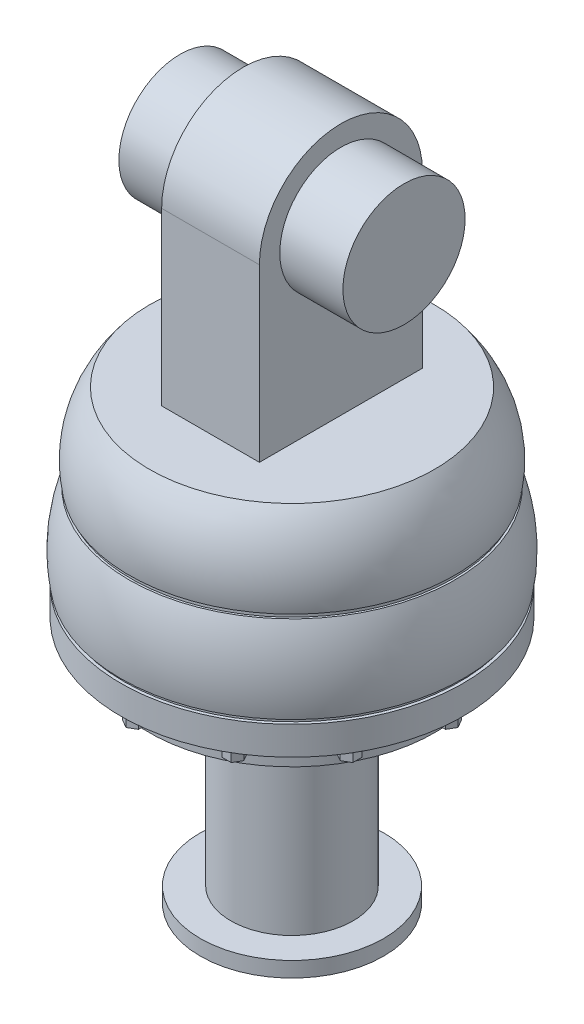
from build123d import *

# Parameters (mm, degrees)
SKETCH2_R            = 39.5
BOSS_EXTRUDE1_DEPTH  = 1
SKETCH4_R            = 41.25
BOSS_EXTRUDE2_DEPTH  = 1
SKETCH5_R            = 42
BOSS_EXTRUDE3_DEPTH  = 7
SKETCH6_R            = 35
BOSS_EXTRUDE4_DEPTH  = 7
BOSS_EXTRUDE7_DEPTH  = 3
CIRPATTERN2_COUNT    = 12
SKETCH8_R            = 15
BOSS_EXTRUDE8_DEPTH  = 50
SKETCH9_W            = 24
SKETCH9_H            = 40
BOSS_EXTRUDE9_DEPTH  = 42
BOSS_EXTRUDE10_START = -24
BOSS_EXTRUDE10_DEPTH = 24
SKETCH11_R           = 15
BOSS_EXTRUDE11_DEPTH = 15.5
BOSS_EXTRUDE12_START = 15.5
SKETCH12_R           = 15
BOSS_EXTRUDE12_DEPTH = 15.5
SKETCH13_R           = 22.5
BOSS_EXTRUDE13_DEPTH = 3.75


with BuildPart() as part:
    # Sketch1 → Revolve1 (revolve)
    with BuildSketch(Plane.XY):
        with BuildLine():
            Line((0, 0), (-35, 0))
            ThreePointArc((-35, 0), (-39.657515479, -9.46062113), (-40, -20))
            Line((-40, -20), (0, -20))
            Line((0, -20), (0, 0))
        make_face()
    revolve(axis=Axis((0, 0, 0), (0, -1, 0)))

    # Sketch2 → Boss-Extrude1 (add)
    with BuildSketch(Plane.XZ.offset(20)):
        Circle(SKETCH2_R)
    extrude(amount=BOSS_EXTRUDE1_DEPTH)

    # Sketch3 → Revolve2 (revolve)
    with BuildSketch(Plane(origin=(0, 0, 0), x_dir=(0, 0, -1), z_dir=(1, 0, 0)), mode=Mode.PRIVATE) as revolve2_sk:
        with BuildLine():
            Line((0, -21), (-40, -21))
            ThreePointArc((-40, -21), (-42.384109041, -30.861589096), (-42, -41))
            Line((-42, -41), (0, -41))
            Line((0, -41), (0, -21))
        make_face()
    revolve(revolve2_sk.sketch.rotate(Axis((0, -21, 0), (0, -1, 0)), 90), axis=Axis((0, -21, 0), (0, -1, 0)))

    # Sketch4 → Boss-Extrude2 (add)
    with BuildSketch(Plane.XZ.offset(41)):
        with Locations(Location((0, 0, 0), (0, 0, 270))):
            Circle(SKETCH4_R)
    extrude(amount=BOSS_EXTRUDE2_DEPTH)

    # Sketch5 → Boss-Extrude3 (add)
    with BuildSketch(Plane.XZ.offset(42)):
        with Locations(Location((0, 0, 0), (0, 0, 270))):
            Circle(SKETCH5_R)
    extrude(amount=BOSS_EXTRUDE3_DEPTH)

    # Sketch6 → Boss-Extrude4 (add)
    with BuildSketch(Plane.XZ.offset(49)):
        with Locations(Location((0, 0, 0), (0, 0, 270))):
            Circle(SKETCH6_R)
    extrude(amount=BOSS_EXTRUDE4_DEPTH)

    # Sketch7 → Boss-Extrude7 (add)
    with BuildSketch(Plane.XZ.offset(49)):
        Polygon((40.75, 0), (39.625, 1.948557159), (37.375, 1.948557159), (36.25, 0), (37.375, -1.948557159), (39.625, -1.948557159), align=None)
        Polygon((39.047649731, 0.948557159), (37.952350269, 0.948557159), (37.404700538, 0), (37.952350269, -0.948557159), (39.047649731, -0.948557159), (39.595299462, 0), align=None, mode=Mode.SUBTRACT)
    boss_extrude7 = extrude(amount=BOSS_EXTRUDE7_DEPTH)

    # CirPattern2: Boss-Extrude7 ×12 about axis
    cirpattern2_axis = Axis((0, 0, 0), (0, 1, 0))
    for i in range(1, CIRPATTERN2_COUNT):
        add(boss_extrude7.rotate(cirpattern2_axis, i * 360 / CIRPATTERN2_COUNT))

    # Sketch8 → Boss-Extrude8 (add)
    with BuildSketch(Plane.XZ.offset(56)):
        with Locations(Location((0, 0, 0), (0, 0, 270))):
            Circle(SKETCH8_R)
    extrude(amount=BOSS_EXTRUDE8_DEPTH)

    # Sketch9 → Boss-Extrude9 (add)
    with BuildSketch(Plane(origin=(0, 0, 0), x_dir=(1, 0, 0), z_dir=(0, 1, 0))):
        Rectangle(SKETCH9_W, SKETCH9_H)
    extrude(amount=BOSS_EXTRUDE9_DEPTH)

    # Sketch10 → Boss-Extrude10 (add)
    with BuildSketch(Plane.ZY.offset(12).offset(BOSS_EXTRUDE10_START)):
        with BuildLine():
            Line((-20, 42), (20, 42))
            ThreePointArc((20, 42), (0, 62), (-20, 42))
        make_face()
    extrude(amount=BOSS_EXTRUDE10_DEPTH)

    # Sketch11 → Boss-Extrude11 (add)
    with BuildSketch(Plane.ZY.offset(12)):
        with Locations(Location((0, 42, 0), (0, 0, 90))):
            Circle(SKETCH11_R)
    extrude(amount=BOSS_EXTRUDE11_DEPTH)

    # Sketch12 → Boss-Extrude12 (add)
    with BuildSketch(Plane(origin=(12, 0, 0), x_dir=(0, 0, -1), z_dir=(1, 0, 0)).offset(BOSS_EXTRUDE12_START)):
        with Locations(Location((0, 42, 0), (0, 0, 90))):
            Circle(SKETCH12_R)
    extrude(amount=-BOSS_EXTRUDE12_DEPTH)

    # Sketch13 → Boss-Extrude13 (add)
    with BuildSketch(Plane.XZ.offset(106)):
        with Locations(Location((0, 0, 0), (0, 0, 270))):
            Circle(SKETCH13_R)
    extrude(amount=BOSS_EXTRUDE13_DEPTH)


solid = part.part
